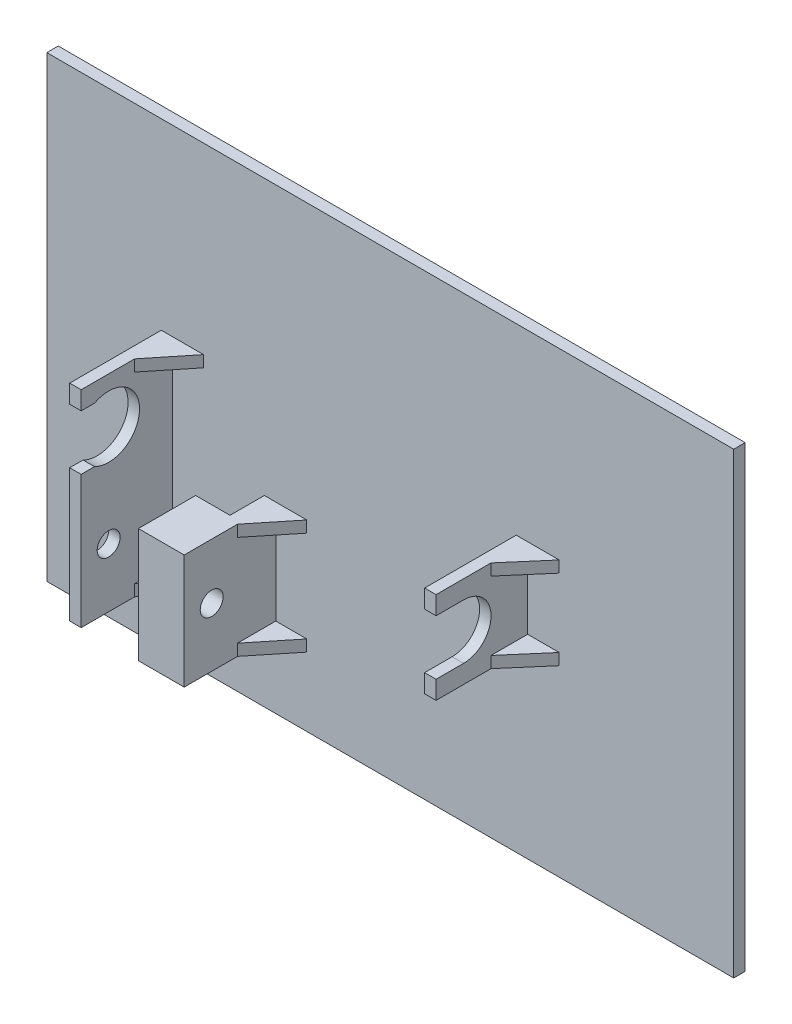
from build123d import *

# Parameters (mm, degrees)
SKETCH1_W            = 300
SKETCH1_H            = 200
BOSS_EXTRUDE1_DEPTH  = 5
SKETCH3_W            = 20
SKETCH3_H            = 20
SKETCH3_H_2          = 40
CUT_EXTRUDE1_DEPTH   = 5
SKETCH4_W            = 20
SKETCH4_H            = 40
CUT_EXTRUDE2_DEPTH   = 10
SKETCH6_W            = 300
SKETCH6_H            = 200
BOSS_EXTRUDE2_DEPTH  = 5
BOSS_EXTRUDE4_DEPTH  = 40
SKETCH8_3_W          = 5
SKETCH8_3_H          = 40
BOSS_EXTRUDE5_DEPTH  = 40
CUT_EXTRUDE3_DEPTH   = 236
SKETCH10_R           = 5
CUT_EXTRUDE4_DEPTH   = 236
BOSS_EXTRUDE6_DEPTH  = 5
BOSS_EXTRUDE7_DEPTH  = 5
BOSS_EXTRUDE8_DEPTH  = 5
CUT_EXTRUDE5_DEPTH   = 10
SKETCH19_W           = 25
SKETCH19_H           = 50
BOSS_EXTRUDE10_DEPTH = 15
BOSS_EXTRUDE11_DEPTH = 5
SKETCH22_R           = 5
CUT_EXTRUDE6_DEPTH   = 39
SKETCH23_R           = 13.5
CUT_EXTRUDE7_DEPTH   = 10


with BuildPart() as part:
    # Sketch1 → Boss-Extrude1 (new body)
    with BuildSketch(Plane.XY):
        Rectangle(SKETCH1_W, SKETCH1_H)
    extrude(amount=BOSS_EXTRUDE1_DEPTH)

    # Sketch3 → Cut-Extrude1 (cut)
    with BuildSketch(Plane.XY.offset(5)):
        with Locations((-140, -90)):
            Rectangle(SKETCH3_W, SKETCH3_H)
        with Locations((-140, 80)):
            Rectangle(SKETCH3_W, SKETCH3_H_2)
        with Locations((140, 80)):
            Rectangle(SKETCH3_W, SKETCH3_H_2)
        with Locations((140, -90)):
            Rectangle(SKETCH3_W, SKETCH3_H)
    extrude(amount=-CUT_EXTRUDE1_DEPTH, mode=Mode.SUBTRACT)

    # Sketch4 → Cut-Extrude2 (cut)
    with BuildSketch(Plane(origin=(0, 0, 0), x_dir=(-1, 0, 0), z_dir=(0, 0, -1))):
        with Locations((-140, -80)):
            Rectangle(SKETCH4_W, SKETCH4_H)
        with Locations((140, -80)):
            Rectangle(SKETCH4_W, SKETCH4_H)
    extrude(amount=-CUT_EXTRUDE2_DEPTH, mode=Mode.SUBTRACT)

    # Sketch6 → Boss-Extrude2 (add)
    with BuildSketch(Plane(origin=(0, 0, 0), x_dir=(-1, 0, 0), z_dir=(0, 0, -1))):
        Rectangle(SKETCH6_W, SKETCH6_H)
    extrude(amount=-BOSS_EXTRUDE2_DEPTH)

    # Sketch8 → Boss-Extrude4 (add)
    with BuildSketch(Plane.XY.offset(5)):
        Polygon((-100, 20), (-95, 20), (-95, -20), (-95, -70), (-100, -70), (-100, -20), align=None)
    boss_extrude4 = extrude(amount=BOSS_EXTRUDE4_DEPTH)

    # Sketch8<3> → Boss-Extrude5 (add)
    with BuildSketch(Plane.XY.offset(5)):
        with Locations((57.5, 0)):
            Rectangle(SKETCH8_3_W, SKETCH8_3_H)
    extrude(amount=BOSS_EXTRUDE5_DEPTH)

    # Sketch9 → Cut-Extrude3 (cut)
    with BuildSketch(Plane(origin=(60, 0, 0), x_dir=(0, 0, -1), z_dir=(1, 0, 0))):
        with BuildLine():
            Line((-45, 12), (-33, 12))
            ThreePointArc((-33, 12), (-21, 0), (-33, -12))
            Line((-33, -12), (-45, -12))
            Line((-45, -12), (-45, 12))
        make_face()
    extrude(amount=-CUT_EXTRUDE3_DEPTH, mode=Mode.SUBTRACT)

    # Sketch10 → Cut-Extrude4 (cut)
    with BuildSketch(Plane(origin=(-95, 0, 0), x_dir=(0, 0, -1), z_dir=(1, 0, 0))):
        with Locations((-33, -44.279864558)):
            Circle(SKETCH10_R)
    cut_extrude4 = extrude(amount=-CUT_EXTRUDE4_DEPTH, mode=Mode.SUBTRACT)

    # Sketch11 → Boss-Extrude6 (add)
    with BuildSketch(Plane.XZ.offset(70)):
        Polygon((-95, 21.66038922), (-81.566809401, 5), (-95, 5), align=None)
    extrude(amount=-BOSS_EXTRUDE6_DEPTH)

    # Sketch12 → Boss-Extrude7 (add)
    with BuildSketch(Plane(origin=(0, 20, 0), x_dir=(1, 0, 0), z_dir=(0, 1, 0))):
        Polygon((60, -21), (73.767048753, -5), (60, -5), align=None)
    boss_extrude7 = extrude(amount=-BOSS_EXTRUDE7_DEPTH)

    # Sketch12<3> → Boss-Extrude8 (add)
    with BuildSketch(Plane(origin=(0, 20, 0), x_dir=(1, 0, 0), z_dir=(0, 1, 0))):
        Polygon((-81.566809401, -5), (-95, -21.66038922), (-95, -5), align=None)
    extrude(amount=-BOSS_EXTRUDE8_DEPTH)

    # Mirror1: Boss-Extrude7 across plane
    add(boss_extrude7.mirror(Plane(origin=(0, 0, 0), x_dir=(0, 0, 1), z_dir=(0, -1, 0))))

    # Mirror3: Boss-Extrude4, Cut-Extrude4 across plane
    add(boss_extrude4.mirror(Plane(origin=(-75, 0, 0), x_dir=(0, 0, 1), z_dir=(1, 0, 0))))
    add(cut_extrude4.mirror(Plane(origin=(-75, 0, 0), x_dir=(0, 0, 1), z_dir=(1, 0, 0))), mode=Mode.SUBTRACT)

    # Sketch17 → Cut-Extrude5 (cut)
    with BuildSketch(Plane.ZY.offset(55)):
        Polygon((5, -20), (45, -20), (45, -12), (45, 20), (5, 20), align=None)
    extrude(amount=-CUT_EXTRUDE5_DEPTH, mode=Mode.SUBTRACT)

    # Sketch19 → Boss-Extrude10 (add)
    with BuildSketch(Plane.ZY.offset(55)):
        with Locations((32.5, -45)):
            Rectangle(SKETCH19_W, SKETCH19_H)
    extrude(amount=BOSS_EXTRUDE10_DEPTH)

    # Sketch20 → Boss-Extrude11 (add)
    with BuildSketch(Plane.XZ.offset(70)):
        Polygon((-50, 21.717977163), (-36.483235136, 5), (-50, 5), align=None)
    boss_extrude11 = extrude(amount=-BOSS_EXTRUDE11_DEPTH)

    # Mirror4: Boss-Extrude11 across plane
    add(boss_extrude11.mirror(Plane.ZX.offset(-45)))

    # Sketch22 → Cut-Extrude6 (cut)
    with BuildSketch(Plane(origin=(-75, 0, 0), x_dir=(0, 0, -1), z_dir=(1, 0, 0))):
        with Locations((-33, -44.279864558)):
            Circle(SKETCH22_R)
    extrude(amount=CUT_EXTRUDE6_DEPTH, mode=Mode.SUBTRACT)

    # Sketch23 → Cut-Extrude7 (cut)
    with BuildSketch(Plane.ZY.offset(100)):
        with Locations((33, 0)):
            Circle(SKETCH23_R)
    extrude(amount=-CUT_EXTRUDE7_DEPTH, mode=Mode.SUBTRACT)


solid = part.part
